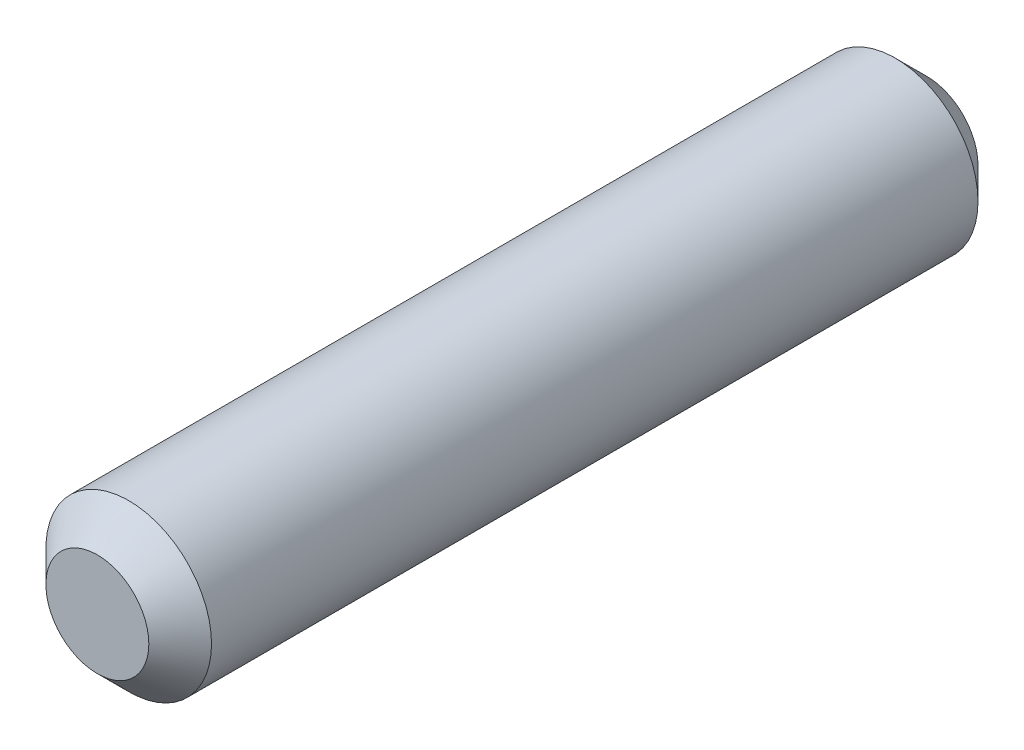
from build123d import *

# Parameters (mm, degrees)
SKETCH2_R           = 1.585
BOSS_EXTRUDE1_DEPTH = 7.935
CHAMFER1_SIZE       = 0.6


with BuildPart() as part:
    # Sketch2 → Boss-Extrude1 (new, symmetric)
    with BuildSketch(Plane.XY):
        Circle(SKETCH2_R)
    extrude(amount=BOSS_EXTRUDE1_DEPTH, both=True)

    # Chamfer1
    chamfer1_edges = [part.edges().sort_by_distance(p)[0] for p in [
        (-1.585, 0, -7.935),
        (-1.585, 0, 7.935),
    ]]
    chamfer(chamfer1_edges, length=CHAMFER1_SIZE)


solid = part.part
